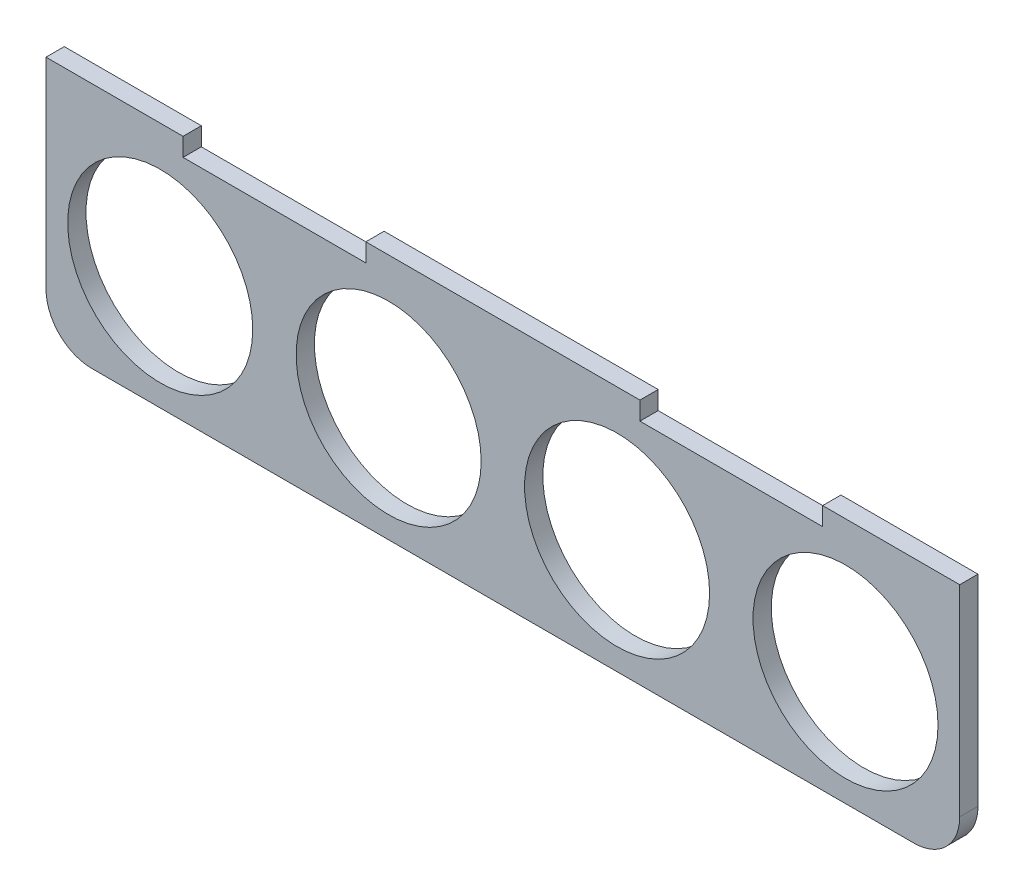
from build123d import *

# Parameters (mm, degrees)
SKETCH1_R           = 20.25
BOSS_EXTRUDE1_DEPTH = 4


with BuildPart() as part:
    # Sketch1 → Boss-Extrude1 (new body)
    with BuildSketch(Plane.XY):
        with BuildLine():
            Line((10, 0), (190, 0))
            ThreePointArc((190, 0), (197.071067812, 2.928932188), (200, 10))
            Line((200, 10), (200, 50))
            Line((200, 50), (200, 54))
            Line((200, 54), (170, 54))
            Line((170, 54), (170, 50))
            Line((170, 50), (130, 50))
            Line((130, 50), (130, 54))
            Line((130, 54), (70, 54))
            Line((70, 54), (70, 50))
            Line((70, 50), (30, 50))
            Line((30, 50), (30, 54))
            Line((30, 54), (0, 54))
            Line((0, 54), (0, 50))
            Line((0, 50), (0, 10))
            ThreePointArc((0, 10), (2.928932188, 2.928932188), (10, 0))
        make_face()
        with Locations((25, 25)):
            Circle(SKETCH1_R, mode=Mode.SUBTRACT)
        with Locations((75, 25)):
            Circle(SKETCH1_R, mode=Mode.SUBTRACT)
        with Locations((125, 25)):
            Circle(SKETCH1_R, mode=Mode.SUBTRACT)
        with Locations((175, 25)):
            Circle(SKETCH1_R, mode=Mode.SUBTRACT)
    extrude(amount=BOSS_EXTRUDE1_DEPTH)


solid = part.part
